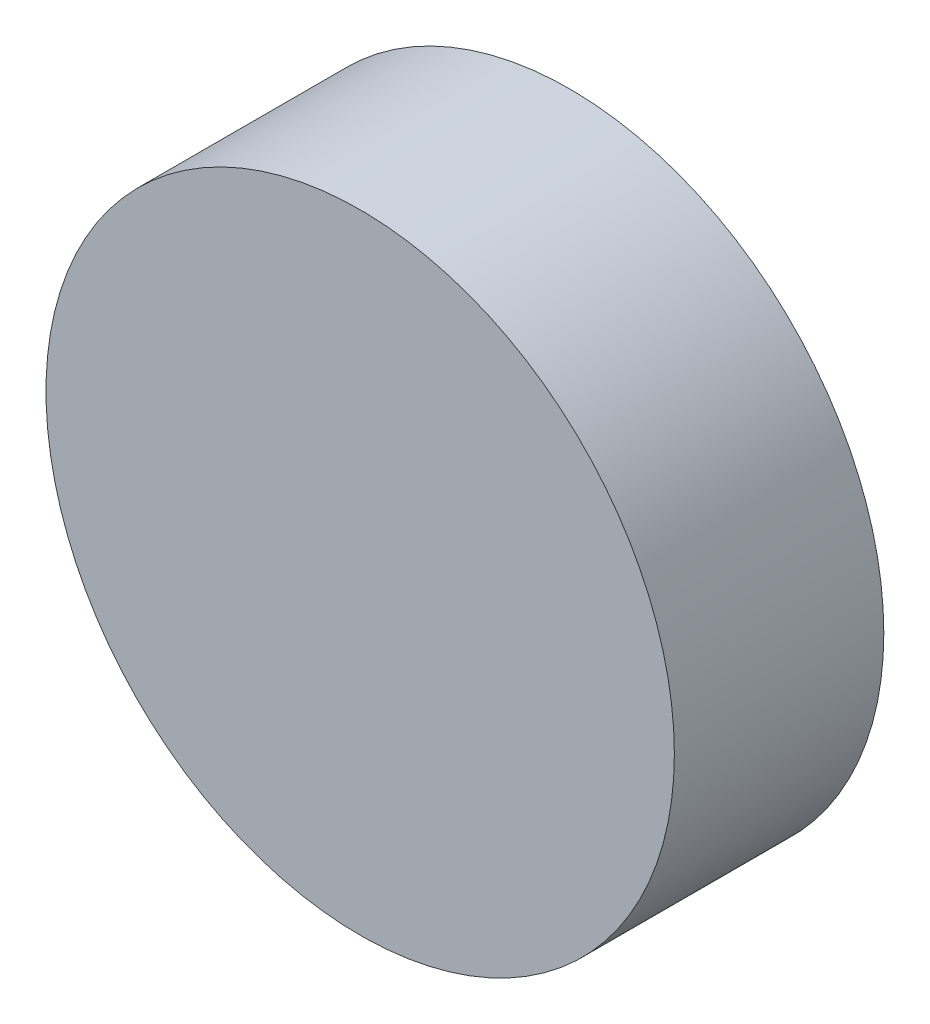
from build123d import *

# Parameters (mm, degrees)
SKETCH_1_R      = 6
EXTRUDE_1_DEPTH = 4


with BuildPart() as part:
    # 草图1 → 凸台-拉伸1 (new body)
    with BuildSketch(Plane.XY):
        Circle(SKETCH_1_R)
    extrude(amount=EXTRUDE_1_DEPTH)


solid = part.part
